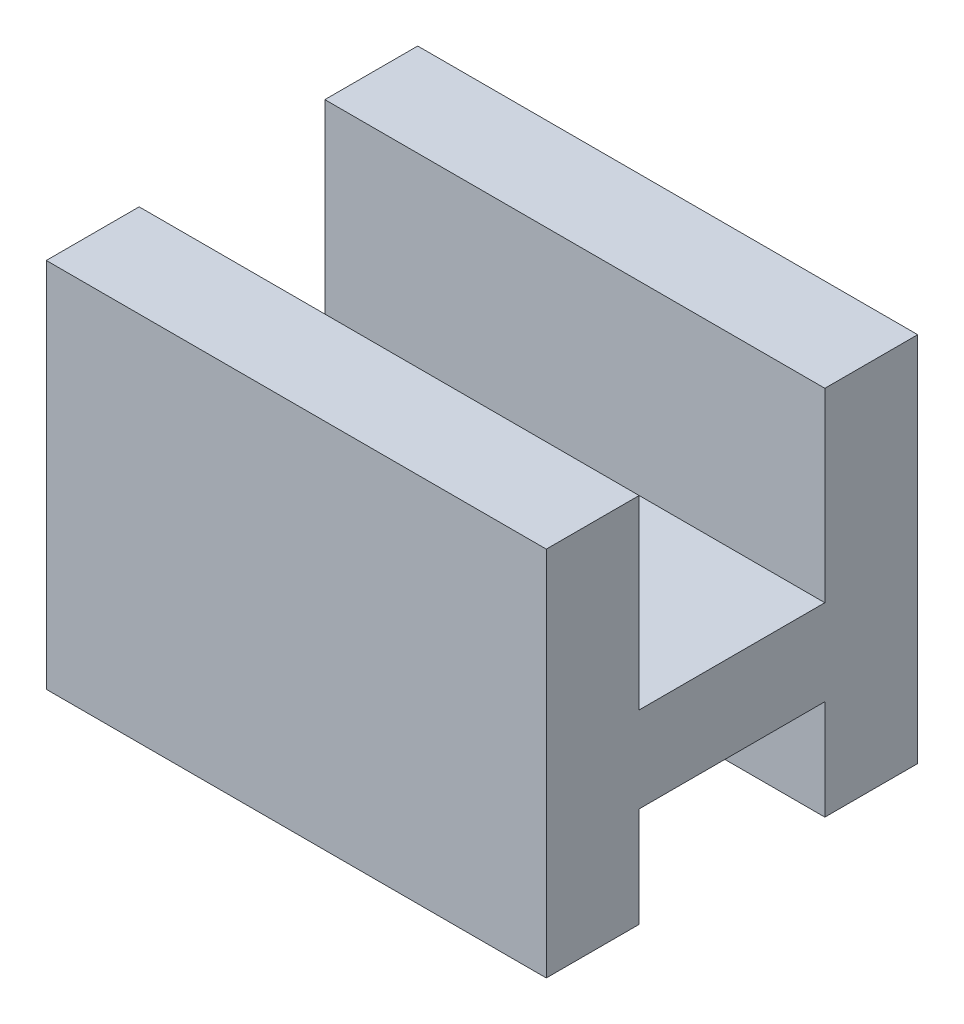
from build123d import *

# Parameters (mm, degrees)
SKETCH_1_W          = 35
SKETCH_1_H          = 26
EXTRUDE_1_DEPTH     = 26
SKETCH_3_W          = 13
SKETCH_3_H          = 13
SKETCH_3_H_2        = 7
CUT_EXTRUDE_1_DEPTH = 43


with BuildPart() as part:
    # 草圖1 → 填料-伸長1 (new body)
    with BuildSketch(Plane.XY):
        Rectangle(SKETCH_1_W, SKETCH_1_H)
    extrude(amount=EXTRUDE_1_DEPTH)

    # 草圖3 → 除料-伸長1 (cut)
    with BuildSketch(Plane.ZY.offset(17.5)):
        with Locations((13, 6.5)):
            Rectangle(SKETCH_3_W, SKETCH_3_H)
        with Locations((13, -9.5)):
            Rectangle(SKETCH_3_W, SKETCH_3_H_2)
    extrude(amount=-CUT_EXTRUDE_1_DEPTH, mode=Mode.SUBTRACT)


solid = part.part
